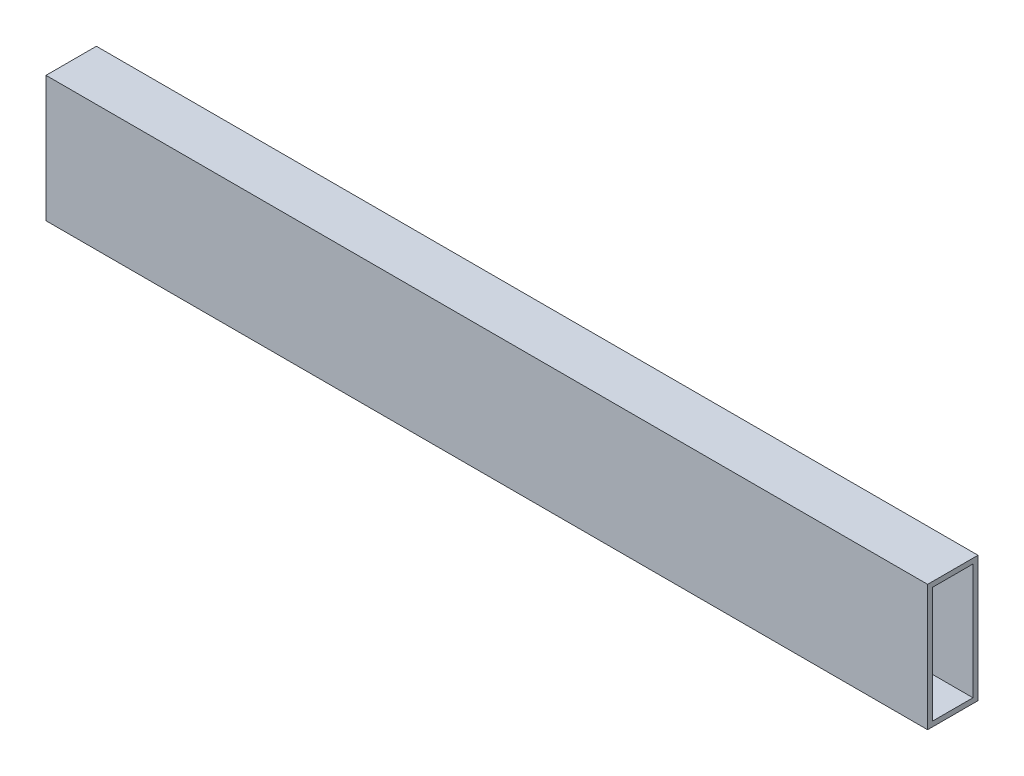
from build123d import *

# Parameters (mm, degrees)
SKETCH_1_W      = 20
SKETCH_1_H      = 50
SKETCH_1_W_2    = 16
SKETCH_1_H_2    = 46
EXTRUDE_1_DEPTH = 350


with BuildPart() as part:
    # Эскиз1 → Бобышка-Вытянуть1 (new body)
    with BuildSketch(Plane(origin=(0, 0, 0), x_dir=(0, 0, -1), z_dir=(1, 0, 0))):
        Rectangle(SKETCH_1_W, SKETCH_1_H)
        Rectangle(SKETCH_1_W_2, SKETCH_1_H_2, mode=Mode.SUBTRACT)
    extrude(amount=EXTRUDE_1_DEPTH)


solid = part.part
